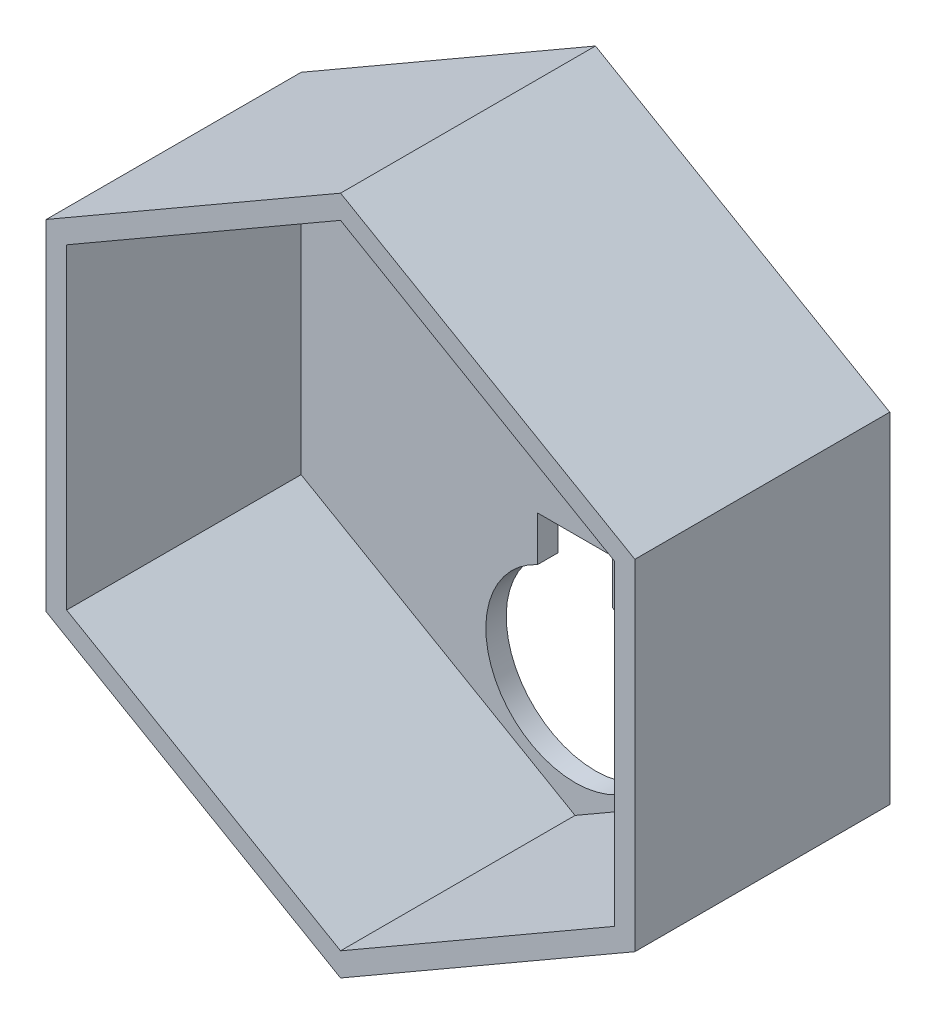
from build123d import *

# Parameters (mm, degrees)
LINEAR_AUSTRAGEN_D_NN1_DEPTH    = 15
AUFSATZ_LINEAR_AUSTRAGEN1_DEPTH = 1.2
SKIZZE3_R                       = 5.25
SCHNITT_LINEAR_AUSTRAGEN1_DEPTH = 1.2
SKIZZE4_W                       = 4.4
SKIZZE4_H                       = 4.707579954
SCHNITT_LINEAR_AUSTRAGEN2_DEPTH = 1.2


with BuildPart() as part:
    # Skizze1 → Linear-Austragen-Dünn1 (new body)
    with BuildSketch(Plane.XY):
        Polygon((0, -20), (17.320508076, -10), (17.320508076, 10), (0, 20), (-17.320508076, 10), (-17.320508076, -10), align=None)
        Polygon((0, -18.614359354), (16.120508076, -9.307179677), (16.120508076, 9.307179677), (0, 18.614359354), (-16.120508076, 9.307179677), (-16.120508076, -9.307179677), align=None, mode=Mode.SUBTRACT)
    extrude(amount=LINEAR_AUSTRAGEN_D_NN1_DEPTH)

    # Skizze2 → Aufsatz-Linear austragen1 (add)
    with BuildSketch(Plane(origin=(0, 0, 0), x_dir=(-1, 0, 0), z_dir=(0, 0, -1))):
        Polygon((-16.120508076, -9.307179677), (-16.120508076, 9.307179677), (0, 18.614359354), (16.120508076, 9.307179677), (16.120508076, -9.307179677), (0, -18.614359354), align=None)
    extrude(amount=-AUFSATZ_LINEAR_AUSTRAGEN1_DEPTH)

    # Skizze3 → Schnitt-Linear austragen1 (cut)
    with BuildSketch(Plane.XY.offset(1.2)):
        with Locations((0, -11.695345197)):
            Circle(SKIZZE3_R)
    extrude(amount=-SCHNITT_LINEAR_AUSTRAGEN1_DEPTH, mode=Mode.SUBTRACT)

    # Skizze4 → Schnitt-Linear austragen2 (cut)
    with BuildSketch(Plane.XY.offset(1.2)):
        with Locations((0, -6.653789977)):
            Rectangle(SKIZZE4_W, SKIZZE4_H)
    extrude(amount=-SCHNITT_LINEAR_AUSTRAGEN2_DEPTH, mode=Mode.SUBTRACT)


solid = part.part
